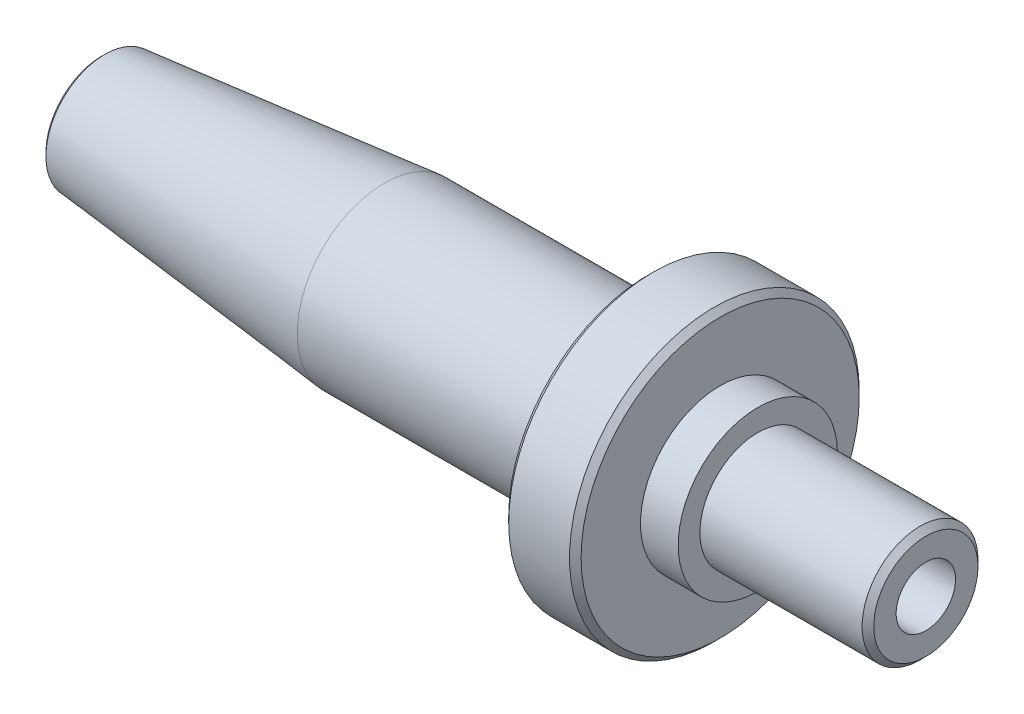
from build123d import *

# Parameters (mm, degrees)
CHANFREIN1_SIZE         = 0.1
CHANFREIN1_SIZE2        = 0.111665285
CHANFREIN2_SIZE         = 0.2
CHANFREIN3_SIZE         = 0.2
TROU_TARAUD_M31_D       = 2.5
TROU_TARAUD_M31_DEPTH   = 8.5
TROU_TARAUD_M31_TIP     = 0.751075774
TROU_TARAUD_M2_51_D     = 2.05
TROU_TARAUD_M2_51_DEPTH = 8.25
TROU_TARAUD_M2_51_TIP   = 0.615882135


with BuildPart() as part:
    # Esquisse1 → Révolution1 (revolve)
    with BuildSketch(Plane.XY, mode=Mode.PRIVATE) as r_volution1_sk:
        Polygon((-14.225, 0), (-14.225, 2.025), (-4.475, 3), (3.625, 3), (3.625, 3.5), (4.625, 3.5), (4.625, 5), (7.125, 5), (7.125, 2.75), (8.425, 2.75), (8.425, 2), (14.225, 2), (14.225, 0), align=None)
    revolve(r_volution1_sk.sketch.rotate(Axis((14.225, 0, 0), (-1, 0, 0)), 90), axis=Axis((14.225, 0, 0), (-1, 0, 0)))

    # Chanfrein1
    chanfrein1_edges = [part.edges().sort_by_distance(p)[0] for p in [
        (-14.225, 0, 2.025),
    ]]
    chanfrein1_side = [part.faces().sort_by_distance(p)[0] for p in [
        (-14.225, 0, 0),
    ]]
    chamfer(chanfrein1_edges, length=CHANFREIN1_SIZE, length2=CHANFREIN1_SIZE2, reference=chanfrein1_side[0])

    # Chanfrein2
    chanfrein2_edges = [part.edges().sort_by_distance(p)[0] for p in [
        (3.625, 0, 3.5),
    ]]
    chamfer(chanfrein2_edges, length=CHANFREIN2_SIZE)

    # Chanfrein3
    chanfrein3_edges = [part.edges().sort_by_distance(p)[0] for p in [
        (7.125, 0, 5),
        (4.625, 0, 5),
        (14.225, 0, 2),
    ]]
    chamfer(chanfrein3_edges, length=CHANFREIN3_SIZE)

    # Trou taraudé M31
    with Locations(Plane.ZY.offset(14.225)):
        with Locations((0, 0)):
            Hole(TROU_TARAUD_M31_D / 2, depth=TROU_TARAUD_M31_DEPTH)
            with Locations((0, 0, -(TROU_TARAUD_M31_DEPTH + TROU_TARAUD_M31_TIP / 2))):  # 118° drill point
                Cone(0, TROU_TARAUD_M31_D / 2, TROU_TARAUD_M31_TIP, mode=Mode.SUBTRACT)

    # Trou taraudé M2.51
    with Locations(Plane(origin=(14.225, 0, 0), x_dir=(0, 0, -1), z_dir=(1, 0, 0))):
        with Locations((0, 0)):
            Hole(TROU_TARAUD_M2_51_D / 2, depth=TROU_TARAUD_M2_51_DEPTH)
            with Locations((0, 0, -(TROU_TARAUD_M2_51_DEPTH + TROU_TARAUD_M2_51_TIP / 2))):  # 118° drill point
                Cone(0, TROU_TARAUD_M2_51_D / 2, TROU_TARAUD_M2_51_TIP, mode=Mode.SUBTRACT)


solid = part.part
